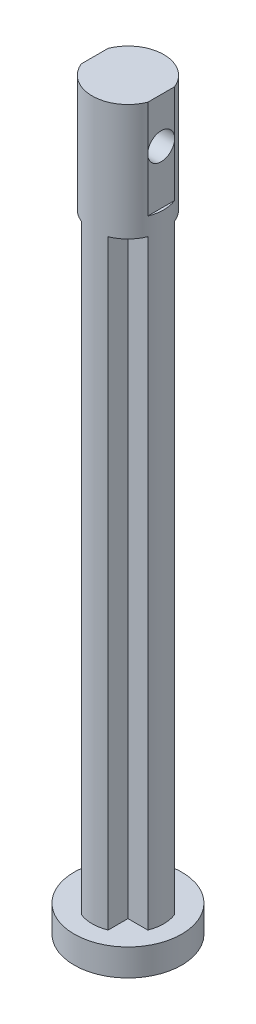
from build123d import *

# Parameters (mm, degrees)
BOSS_EXTRUDE1_DEPTH = 67
BOSS_EXTRUDE2_START = 13
SKETCH1_3_R         = 4
BOSS_EXTRUDE2_DEPTH = 13
BOSS_EXTRUDE3_START = -67
SKETCH1_4_R         = 6
BOSS_EXTRUDE3_DEPTH = 3
CUT_EXTRUDE1_DEPTH  = 11
SKETCH3_R           = 1.5
CUT_EXTRUDE2_DEPTH  = 4


with BuildPart() as part:
    # Sketch1 → Boss-Extrude1 (new body)
    with BuildSketch(Plane(origin=(0, 0, 0), x_dir=(1, 0, 0), z_dir=(0, 1, 0))):
        with BuildLine():
            Line((1.5, 1.5), (1.5, 3.708099244))
            ThreePointArc((1.5, 3.708099244), (0, 4), (-1.5, 3.708099244))
            Line((-1.5, 3.708099244), (-1.5, 1.5))
            Line((-1.5, 1.5), (-3.708099244, 1.5))
            ThreePointArc((-3.708099244, 1.5), (-4, 0), (-3.708099244, -1.5))
            Line((-3.708099244, -1.5), (-1.5, -1.5))
            Line((-1.5, -1.5), (-1.5, -3.708099244))
            ThreePointArc((-1.5, -3.708099244), (0, -4), (1.5, -3.708099244))
            Line((1.5, -3.708099244), (1.5, -1.5))
            Line((1.5, -1.5), (3.708099244, -1.5))
            ThreePointArc((3.708099244, -1.5), (3.92634671, -0.76406905), (4, 0))
            ThreePointArc((4, 0), (3.92634671, 0.76406905), (3.708099244, 1.5))
            Line((3.708099244, 1.5), (1.5, 1.5))
        make_face()
    extrude(amount=-BOSS_EXTRUDE1_DEPTH)

    # Sketch1<3> → Boss-Extrude2 (add)
    with BuildSketch(Plane(origin=(0, 0, 0), x_dir=(1, 0, 0), z_dir=(0, 1, 0)).offset(BOSS_EXTRUDE2_START)):
        Circle(SKETCH1_3_R)
    extrude(amount=-BOSS_EXTRUDE2_DEPTH)

    # Sketch1<4> → Boss-Extrude3 (add)
    with BuildSketch(Plane(origin=(0, 0, 0), x_dir=(1, 0, 0), z_dir=(0, 1, 0)).offset(BOSS_EXTRUDE3_START)):
        Circle(SKETCH1_4_R)
    extrude(amount=-BOSS_EXTRUDE3_DEPTH)

    # Sketch2 → Cut-Extrude1 (cut)
    with BuildSketch(Plane(origin=(0, 13, 0), x_dir=(1, 0, 0), z_dir=(0, 1, 0))):
        with BuildLine():
            Line((3.708099244, 1.5), (3.708099244, -1.5))
            ThreePointArc((3.708099244, -1.5), (4, 0), (3.708099244, 1.5))
        make_face()
    cut_extrude1 = extrude(amount=-CUT_EXTRUDE1_DEPTH, mode=Mode.SUBTRACT)

    # Sketch3 → Cut-Extrude2 (cut)
    with BuildSketch(Plane(origin=(3.708099244, 0, 0), x_dir=(0, 0, -1), z_dir=(1, 0, 0))):
        with Locations((0, 8)):
            Circle(SKETCH3_R)
    cut_extrude2 = extrude(amount=-CUT_EXTRUDE2_DEPTH, mode=Mode.SUBTRACT)

    # Mirror1: Cut-Extrude1, Cut-Extrude2 across plane
    add(cut_extrude1.mirror(Plane(origin=(0, 0, 0), x_dir=(0, 0, 1), z_dir=(1, 0, 0))), mode=Mode.SUBTRACT)
    add(cut_extrude2.mirror(Plane(origin=(0, 0, 0), x_dir=(0, 0, 1), z_dir=(1, 0, 0))), mode=Mode.SUBTRACT)


solid = part.part
